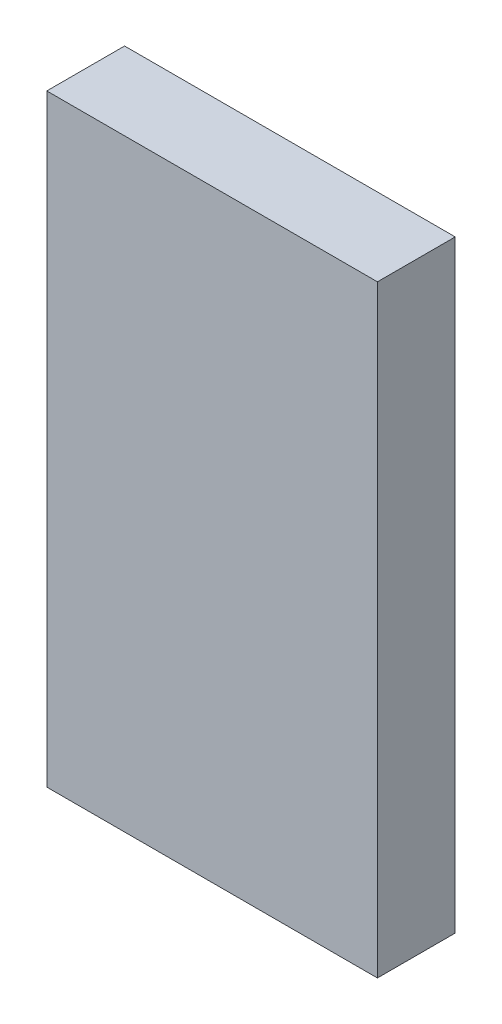
from build123d import *

# Parameters (mm, degrees)
SKETCH1_W           = 17
SKETCH1_H           = 4
BOSS_EXTRUDE1_DEPTH = 31


with BuildPart() as part:
    # Sketch1 → Boss-Extrude1 (new body)
    with BuildSketch(Plane(origin=(0, 0, 0), x_dir=(1, 0, 0), z_dir=(0, 1, 0))):
        with Locations((8.5, 2)):
            Rectangle(SKETCH1_W, SKETCH1_H)
    extrude(amount=BOSS_EXTRUDE1_DEPTH)


solid = part.part
